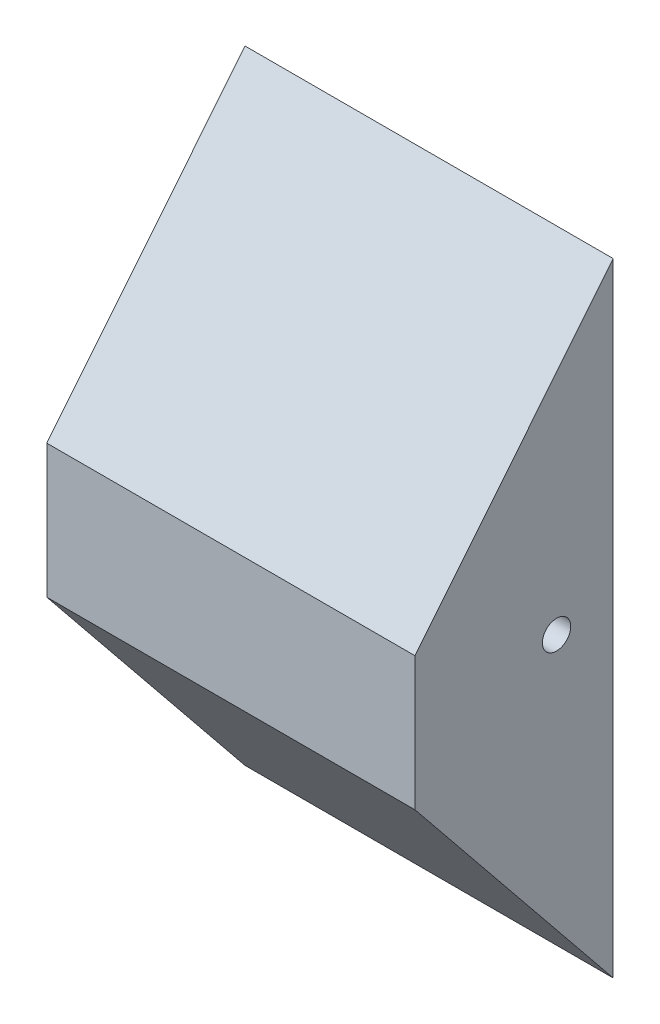
from build123d import *

# Parameters (mm, degrees)
IZIM1_W                     = 13
IZIM1_H                     = 22
Y_KSEKLIK_EKSTR_ZYON1_DEPTH = 7
KES_EKSTR_ZYON1_DEPTH       = 19.41195264
IZIM3_W                     = 0.583664442
IZIM3_H                     = 4.902781318
IZIM3_R                     = 2.271047272
Y_KSEKLIK_EKSTR_ZYON2_DEPTH = 0.5
IZIM4_R                     = 1.923937322
KES_EKSTR_ZYON2_DEPTH       = 0.5
IZIM5_R                     = 0.5
KES_EKSTR_ZYON3_DEPTH       = 19.41195264


with BuildPart() as part:
    # Çizim1 → Yükseklik-Ekstrüzyon1 (new body)
    with BuildSketch(Plane.XY):
        Rectangle(IZIM1_W, IZIM1_H)
    extrude(amount=Y_KSEKLIK_EKSTR_ZYON1_DEPTH)

    # Çizim2 → Kes-Ekstrüzyon1 (cut, through all)
    with BuildSketch(Plane(origin=(6.5, 0, 0), x_dir=(0, 0, -1), z_dir=(1, 0, 0))):
        Polygon((-7, 2.355719904), (0, 11), (-7, 11), align=None)
        Polygon((0, -11), (-7, -2.355719904), (-7, -11), align=None)
    extrude(amount=-KES_EKSTR_ZYON1_DEPTH, mode=Mode.SUBTRACT)

    # Çizim3 → Yükseklik-Ekstrüzyon2 (add)
    with BuildSketch(Plane(origin=(0, 0, 0), x_dir=(-1, 0, 0), z_dir=(0, 0, -1))):
        with Locations((0, 6)):
            Rectangle(IZIM3_W, IZIM3_H)
        with Locations(Location((0, -6, 0), (0, 0, 180))):
            Circle(IZIM3_R)
    extrude(amount=Y_KSEKLIK_EKSTR_ZYON2_DEPTH)

    # Çizim4 → Kes-Ekstrüzyon2 (cut)
    with BuildSketch(Plane(origin=(0, 0, -0.5), x_dir=(-1, 0, 0), z_dir=(0, 0, -1))):
        with Locations((0, -6)):
            Circle(IZIM4_R)
    extrude(amount=-KES_EKSTR_ZYON2_DEPTH, mode=Mode.SUBTRACT)

    # Çizim5 → Kes-Ekstrüzyon3 (cut, through all)
    with BuildSketch(Plane(origin=(6.5, 0, 0), x_dir=(0, 0, -1), z_dir=(1, 0, 0))):
        with Locations(Location((-2, 0.5, 0), (0, 0, 90))):
            Circle(IZIM5_R)
    extrude(amount=-KES_EKSTR_ZYON3_DEPTH, mode=Mode.SUBTRACT)


solid = part.part
